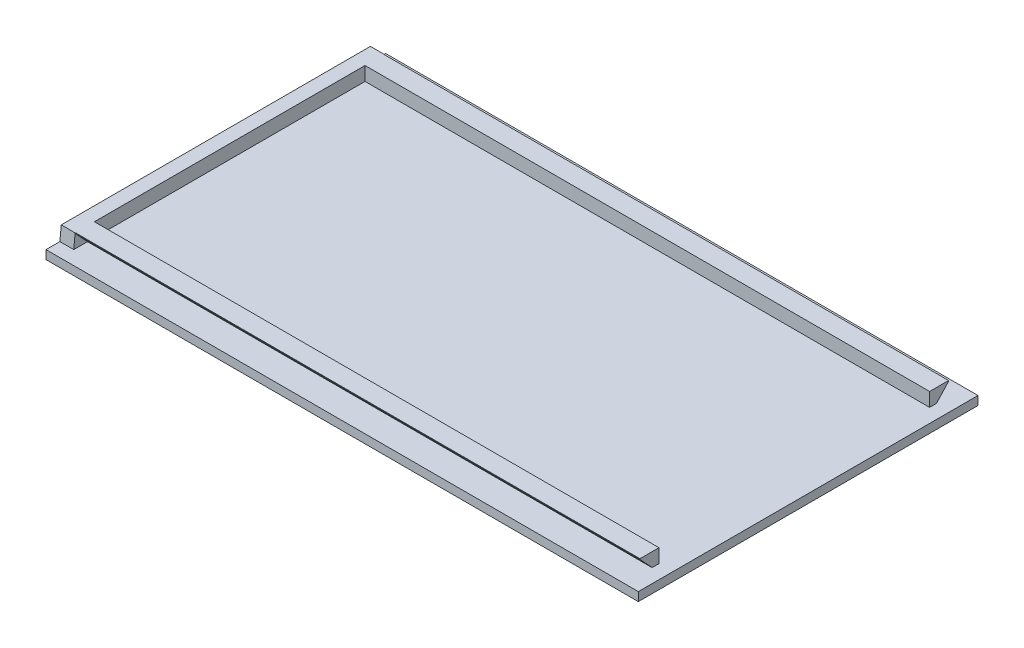
from build123d import *

# Parameters (mm, degrees)
ESBO_O1_W                = 85.8
ESBO_O1_H                = 49.2
RESSALTO_EXTRUS_O1_DEPTH = 1.26
RESSALTO_EXTRUS_O5_DEPTH = 2.01
RESSALTO_EXTRUS_O6_REACH = 102.969
RESSALTO_EXTRUS_O6_START = -2.01
CORTE_EXTRUS_O4_DEPTH    = 0.6


with BuildPart() as part:
    # Esboço1 → Ressalto-extrusão1 (new body)
    with BuildSketch(Plane(origin=(0, 0, 0), x_dir=(1, 0, 0), z_dir=(0, 1, 0))):
        with Locations((42.9, 24.6)):
            Rectangle(ESBO_O1_W, ESBO_O1_H)
    extrude(amount=RESSALTO_EXTRUS_O1_DEPTH)

    # Esboço9 → Ressalto-extrusão5 (add)
    with BuildSketch(Plane.ZY):
        Polygon((-47.19, 1.26), (-46.989750156, 3.26), (-2.210249844, 3.26), (-2.01, 1.26), align=None)
    extrude(amount=-RESSALTO_EXTRUS_O5_DEPTH)

    # Esboço11 → Ressalto-extrusão6 (add, up to next)
    with BuildSketch(Plane(origin=(85.8, 0, 0), x_dir=(0, 0, -1), z_dir=(1, 0, 0)).offset(RESSALTO_EXTRUS_O6_START), mode=Mode.PRIVATE) as ressalto_extrus_o6_sk1:
        Polygon((44.2, 1.26), (45.2, 1.26), (46.959846557, 3.16027369), (46.952453114, 3.26), (44.2, 3.26), align=None)
    ressalto_extrus_o6_tool1 = extrude(ressalto_extrus_o6_sk1.sketch, amount=-RESSALTO_EXTRUS_O6_REACH, mode=Mode.PRIVATE) - part.part
    # Esboço11 → Ressalto-extrusão6 (add, up to next)
    with BuildSketch(Plane(origin=(85.8, 0, 0), x_dir=(0, 0, -1), z_dir=(1, 0, 0)).offset(RESSALTO_EXTRUS_O6_START), mode=Mode.PRIVATE) as ressalto_extrus_o6_sk2:
        Polygon((5, 3.26), (5, 1.26), (4, 1.26), (2.240153443, 3.16027369), (2.247546886, 3.26), align=None)
    ressalto_extrus_o6_tool2 = extrude(ressalto_extrus_o6_sk2.sketch, amount=-RESSALTO_EXTRUS_O6_REACH, mode=Mode.PRIVATE) - part.part
    add(ressalto_extrus_o6_tool1.solids().sort_by_distance((83.79, 2.41923, -45.235001))[0])
    add(ressalto_extrus_o6_tool2.solids().sort_by_distance((83.79, 2.41923, -3.964999))[0])

    # Esboço8 → Corte-extrusão4 (cut)
    with BuildSketch(Plane.XZ):
        with BuildLine():
            ThreePointArc((22.054636183, -24.574784692), (19.006183567, -30.839043664), (24.543756305, -35.066252199))
            ThreePointArc((24.543756305, -35.066252199), (34.411504106, -32.18495748), (41.324551108, -24.576798237))
            ThreePointArc((41.324551108, -24.576798237), (34.411504106, -16.968638994), (24.543756305, -14.087344275))
            ThreePointArc((24.543756305, -14.087344275), (19.015675216, -18.314400935), (22.054636183, -24.574784692))
        make_face()
        with BuildLine():
            ThreePointArc((24.533243249, -14.587267716), (19.371981333, -19.36170914), (24.08768254, -24.576695007))
            ThreePointArc((24.08768254, -24.576695007), (19.36258934, -29.791975707), (24.532809194, -34.566332751))
            ThreePointArc((24.532809194, -34.566332751), (34.03743393, -31.828610978), (40.763816601, -24.576798237))
            ThreePointArc((40.763816601, -24.576798237), (34.037618764, -17.325099255), (24.533243249, -14.587267716))
        make_face(mode=Mode.SUBTRACT)
    extrude(amount=-CORTE_EXTRUS_O4_DEPTH, mode=Mode.SUBTRACT)


solid = part.part
